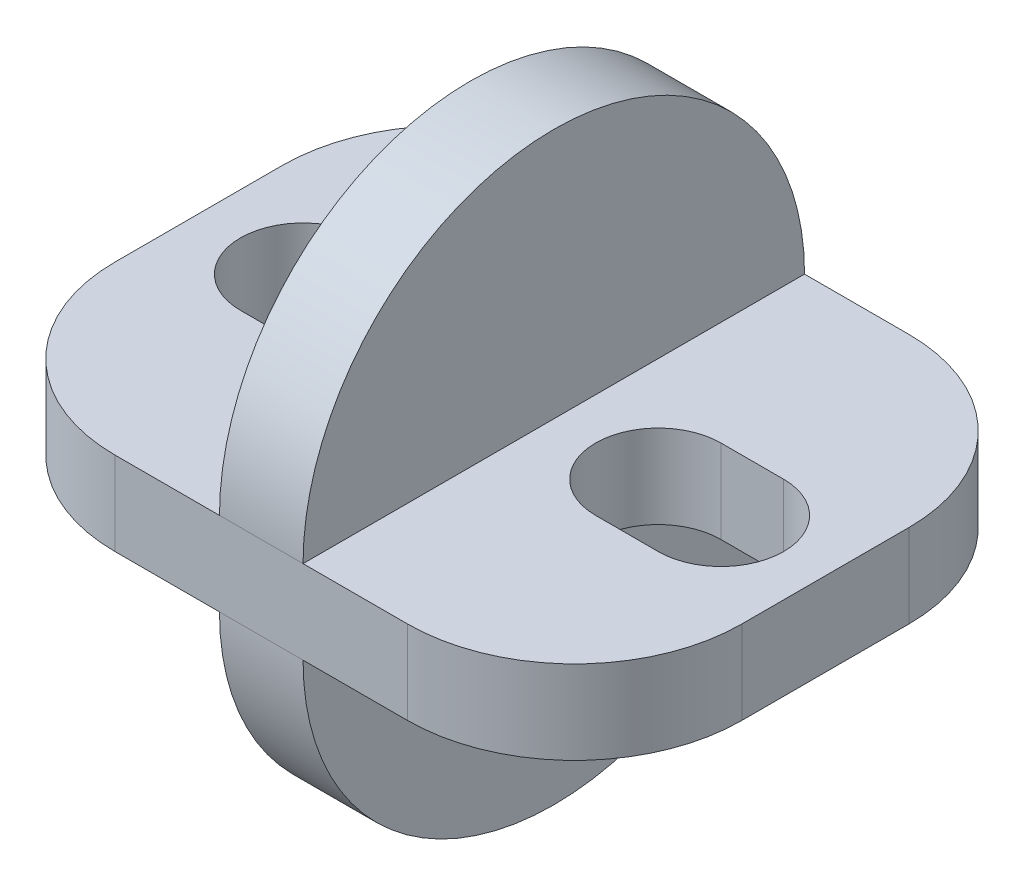
from build123d import *

# Parameters (mm, degrees)
CROQUIS1_W              = 150
CROQUIS1_H              = 120
SALIENTE_EXTRUIR1_DEPTH = 20
REDONDEO1_R             = 40
SALIENTE_EXTRUIR3_DEPTH = 10
CORTAR_EXTRUIR1_DEPTH   = 33.5


with BuildPart() as part:
    # Croquis1 → Saliente-Extruir1 (new body)
    with BuildSketch(Plane(origin=(0, 0, 0), x_dir=(1, 0, 0), z_dir=(0, 1, 0))):
        Rectangle(CROQUIS1_W, CROQUIS1_H)
    extrude(amount=SALIENTE_EXTRUIR1_DEPTH)

    # Redondeo1
    redondeo1_edges = [part.edges().sort_by_distance(p)[0] for p in [
        (-75, 10, -60),
        (75, 10, -60),
        (75, 10, 60),
        (-75, 10, 60),
    ]]
    fillet(redondeo1_edges, radius=REDONDEO1_R)

    # Croquis3 → Saliente-Extruir3 (add, symmetric)
    with BuildSketch(Plane(origin=(0, 0, 0), x_dir=(0, 0, -1), z_dir=(1, 0, 0))):
        with BuildLine():
            Line((-60, 20), (60, 20))
            ThreePointArc((60, 20), (0, 80), (-60, 20))
        make_face()
        with BuildLine():
            Line((60, 0), (-60, 0))
            ThreePointArc((-60, 0), (0, -60), (60, 0))
        make_face()
    extrude(amount=SALIENTE_EXTRUIR3_DEPTH, both=True)

    # Croquis4 → Cortar-Extruir1 (cut, symmetric)
    with BuildSketch(Plane(origin=(0, 20, 0), x_dir=(1, 0, 0), z_dir=(0, 1, 0))):
        with BuildLine():
            Line((-50, 15), (-35, 15))
            ThreePointArc((-35, 15), (-20, 0), (-35, -15))
            Line((-35, -15), (-50, -15))
            ThreePointArc((-50, -15), (-65, 0), (-50, 15))
        make_face()
        with BuildLine():
            Line((50, -15), (35, -15))
            ThreePointArc((35, -15), (20, 0), (35, 15))
            Line((35, 15), (50, 15))
            ThreePointArc((50, 15), (65, 0), (50, -15))
        make_face()
    extrude(amount=CORTAR_EXTRUIR1_DEPTH, both=True, mode=Mode.SUBTRACT)


solid = part.part
